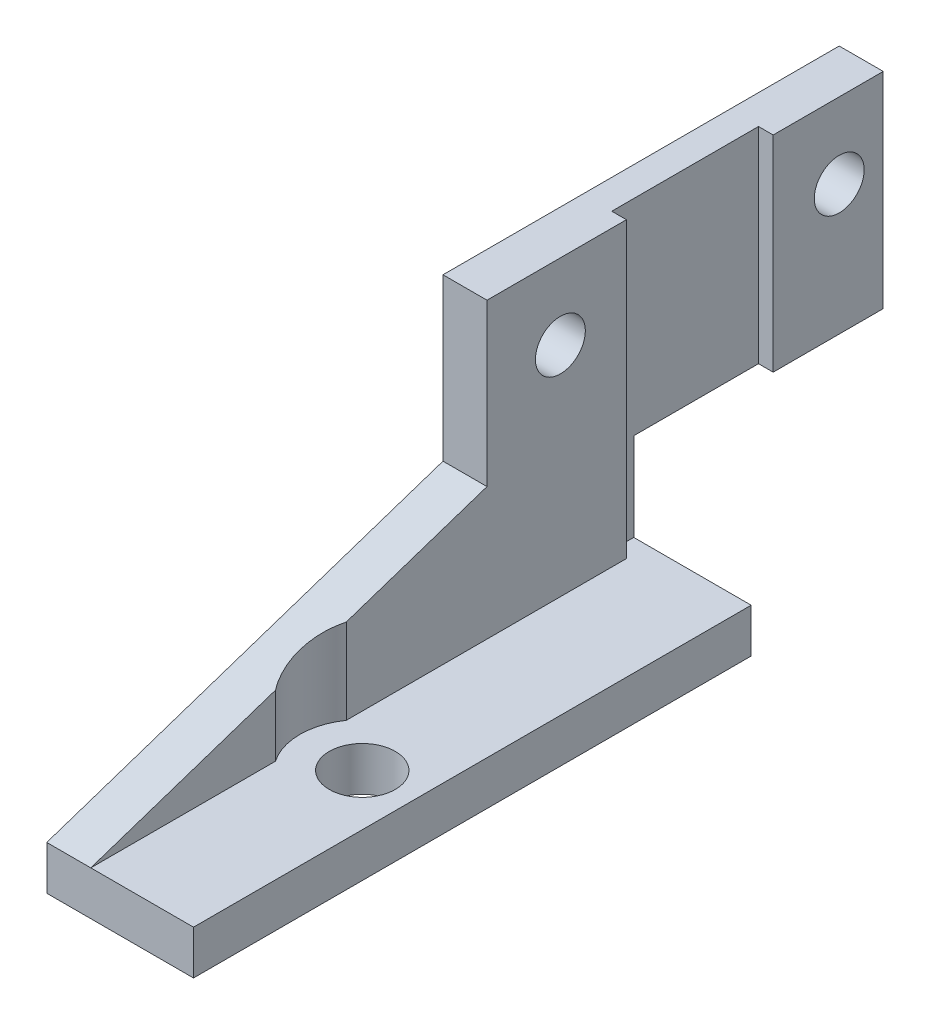
from build123d import *

# Parameters (mm, degrees)
BOSS_EXTRUDE1_DEPTH = 27
SKETCH3_R           = 1.7
CUT_EXTRUDE2_DEPTH  = 35.322004603
SKETCH4_W           = 10
SKETCH4_H           = 20
CUT_EXTRUDE3_DEPTH  = 1
SKETCH5_R           = 2.25
CUT_EXTRUDE4_DEPTH  = 36.057096286
BOSS_EXTRUDE2_DEPTH = 3
SKETCH7_W           = 7
SKETCH7_H           = 3
BOSS_EXTRUDE3_DEPTH = 27
SKETCH8_R           = 2.25
CUT_EXTRUDE5_DEPTH  = 59.446556785
SKETCH9_R           = 4.25
CUT_EXTRUDE6_DEPTH  = 59.446556785
SKETCH11_W          = 16
SKETCH11_H          = 9
CUT_EXTRUDE7_DEPTH  = 59.446556785


with BuildPart() as part:
    # Sketch1 → Boss-Extrude1 (new body)
    with BuildSketch(Plane.XY):
        Polygon((0, 0), (0, 20), (3, 20), (3, 0), (10, 0), (10, -3), (0, -3), align=None)
    extrude(amount=BOSS_EXTRUDE1_DEPTH)

    # Sketch3 → Cut-Extrude2 (cut, through all)
    with BuildSketch(Plane(origin=(3, 0, 0), x_dir=(0, 0, -1), z_dir=(1, 0, 0))):
        with Locations(Location((-22, 14.85, 0), (0, 0, 90))):
            Circle(SKETCH3_R)
        with Locations(Location((-3, 14.85, 0), (0, 0, 90))):
            Circle(SKETCH3_R)
    extrude(amount=-CUT_EXTRUDE2_DEPTH, mode=Mode.SUBTRACT)

    # Sketch4 → Cut-Extrude3 (cut)
    with BuildSketch(Plane(origin=(3, 0, 0), x_dir=(0, 0, -1), z_dir=(1, 0, 0))):
        with Locations((-12.5, 10)):
            Rectangle(SKETCH4_W, SKETCH4_H)
    extrude(amount=-CUT_EXTRUDE3_DEPTH, mode=Mode.SUBTRACT)

    # Sketch5 → Cut-Extrude4 (cut, through all)
    with BuildSketch(Plane(origin=(0, 0, 0), x_dir=(1, 0, 0), z_dir=(0, 1, 0))):
        with Locations(Location((6.5, -9, 0), (0, 0, 270))):
            Circle(SKETCH5_R)
    extrude(amount=-CUT_EXTRUDE4_DEPTH, mode=Mode.SUBTRACT)

    # Sketch6 → Boss-Extrude2 (add)
    with BuildSketch(Plane.ZY):
        Polygon((27, 9), (54, 0), (54, -3), (27, -3), align=None)
    extrude(amount=-BOSS_EXTRUDE2_DEPTH)

    # Sketch7 → Boss-Extrude3 (add)
    with BuildSketch(Plane.XY.offset(27)):
        with Locations((6.5, -1.5)):
            Rectangle(SKETCH7_W, SKETCH7_H)
    extrude(amount=BOSS_EXTRUDE3_DEPTH)

    # Sketch8 → Cut-Extrude5 (cut, through all)
    with BuildSketch(Plane(origin=(0, 0, 0), x_dir=(1, 0, 0), z_dir=(0, 1, 0))):
        with Locations(Location((6.5, -39, 0), (0, 0, 270))):
            Circle(SKETCH8_R)
    extrude(amount=-CUT_EXTRUDE5_DEPTH, mode=Mode.SUBTRACT)

    # Sketch9 → Cut-Extrude6 (cut, through all)
    with BuildSketch(Plane(origin=(0, 0, 0), x_dir=(1, 0, 0), z_dir=(0, 1, 0))):
        with Locations((6.5, -39)):
            Circle(SKETCH9_R)
    extrude(amount=CUT_EXTRUDE6_DEPTH, mode=Mode.SUBTRACT)

    # Sketch11 → Cut-Extrude7 (cut, through all)
    with BuildSketch(Plane(origin=(10, 0, 0), x_dir=(0, 0, -1), z_dir=(1, 0, 0))):
        with Locations((-8, 1.5)):
            Rectangle(SKETCH11_W, SKETCH11_H)
    extrude(amount=-CUT_EXTRUDE7_DEPTH, mode=Mode.SUBTRACT)


solid = part.part
